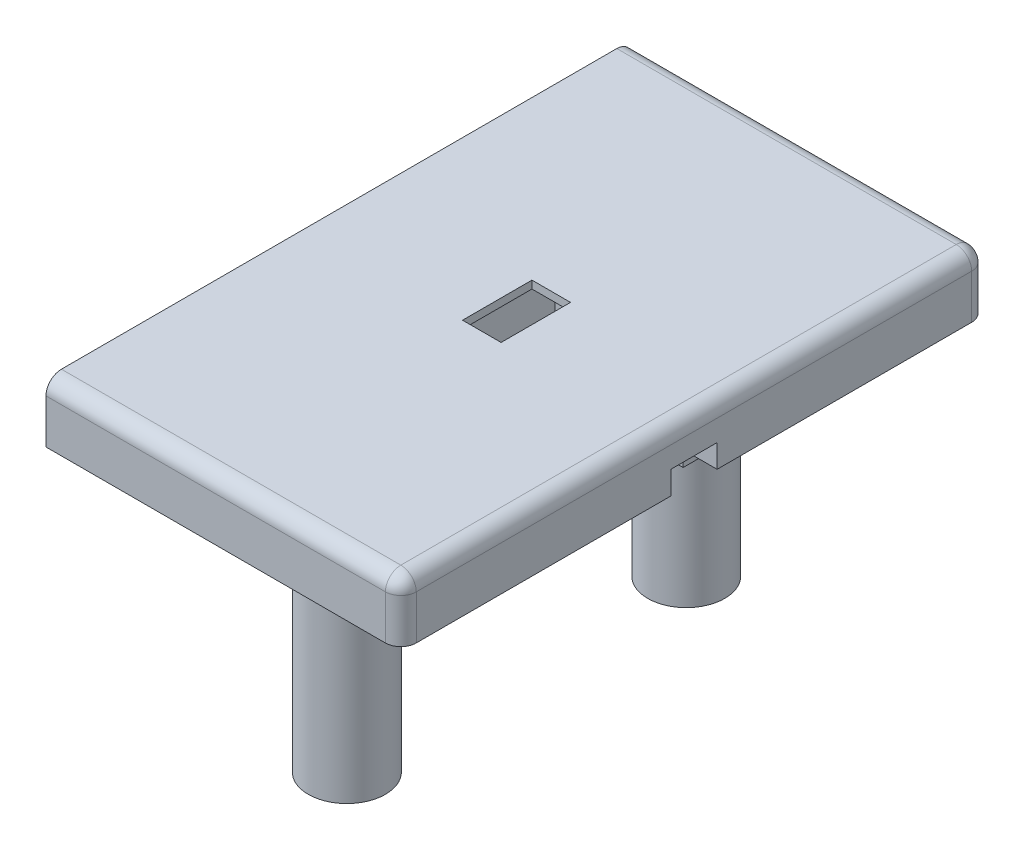
from build123d import *

# Parameters (mm, degrees)
SKETCH1_W           = 23
SKETCH1_H           = 38
BOSS_EXTRUDE1_DEPTH = 4.87
FILLET1_R           = 1
SKETCH2_W           = 23
SKETCH2_H           = 38
SKETCH2_W_2         = 18.6
SKETCH2_H_2         = 33.6
CUT_EXTRUDE1_DEPTH  = 1
SKETCH3_W           = 5
SKETCH3_H           = 10
CUT_EXTRUDE2_DEPTH  = 4.37
CUT_EXTRUDE3_REACH  = 24.635
SKETCH4_W           = 2.5
SKETCH4_H           = 4.5
SKETCH5_R           = 2.5
BOSS_EXTRUDE2_DEPTH = 15.5
SKETCH6_R           = 0.95
CUT_EXTRUDE4_DEPTH  = 6
SKETCH7_W           = 3
SKETCH7_H           = 5
CUT_EXTRUDE5_DEPTH  = 4.2


with BuildPart() as part:
    # Sketch1 → Boss-Extrude1 (new body)
    with BuildSketch(Plane(origin=(0, 0, 0), x_dir=(1, 0, 0), z_dir=(0, 1, 0))):
        Rectangle(SKETCH1_W, SKETCH1_H)
    extrude(amount=BOSS_EXTRUDE1_DEPTH)

    # Fillet1
    fillet1_edges = [part.edges().sort_by_distance(p)[0] for p in [
        (0, 4.87, 19),
        (11.5, 4.87, 0),
        (0, 4.87, -19),
        (11.5, 2.435, 19),
        (11.5, 2.435, -19),
    ]]
    fillet(fillet1_edges, radius=FILLET1_R)

    # Sketch2 → Cut-Extrude1 (cut)
    with BuildSketch(Plane.XZ):
        Rectangle(SKETCH2_W, SKETCH2_H)
        Rectangle(SKETCH2_W_2, SKETCH2_H_2, mode=Mode.SUBTRACT)
    extrude(amount=-CUT_EXTRUDE1_DEPTH, mode=Mode.SUBTRACT)

    # Sketch3 → Cut-Extrude2 (cut)
    with BuildSketch(Plane.XZ):
        Rectangle(SKETCH3_W, SKETCH3_H)
    extrude(amount=-CUT_EXTRUDE2_DEPTH, mode=Mode.SUBTRACT)

    # Sketch4 → Cut-Extrude3 (cut, up to next)
    with BuildSketch(Plane.XZ.offset(-4.37), mode=Mode.PRIVATE) as cut_extrude3_sk1:
        Rectangle(SKETCH4_W, SKETCH4_H)
    cut_extrude3_tool1 = extrude(cut_extrude3_sk1.sketch, amount=-CUT_EXTRUDE3_REACH, mode=Mode.PRIVATE) & part.part
    add(cut_extrude3_tool1.solids().sort_by_distance((0, 4.37, 0))[0], mode=Mode.SUBTRACT)

    # Sketch5 → Boss-Extrude2 (add)
    with BuildSketch(Plane.XZ):
        with Locations(Location((0, -11, 0), (0, 0, 90))):
            Circle(SKETCH5_R)
        with Locations(Location((0, 11, 0), (0, 0, 90))):
            Circle(SKETCH5_R)
    extrude(amount=BOSS_EXTRUDE2_DEPTH)

    # Sketch6 → Cut-Extrude4 (cut)
    with BuildSketch(Plane.XZ.offset(15.5)):
        with Locations(Location((0, -11, 0), (0, 0, 270))):
            Circle(SKETCH6_R)
        with Locations(Location((0, 11, 0), (0, 0, 270))):
            Circle(SKETCH6_R)
    extrude(amount=-CUT_EXTRUDE4_DEPTH, mode=Mode.SUBTRACT)

    # Sketch7 → Cut-Extrude5 (cut)
    with BuildSketch(Plane(origin=(11.5, 0, 0), x_dir=(0, 0, -1), z_dir=(1, 0, 0))):
        Rectangle(SKETCH7_W, SKETCH7_H)
    extrude(amount=-CUT_EXTRUDE5_DEPTH, mode=Mode.SUBTRACT)


solid = part.part
